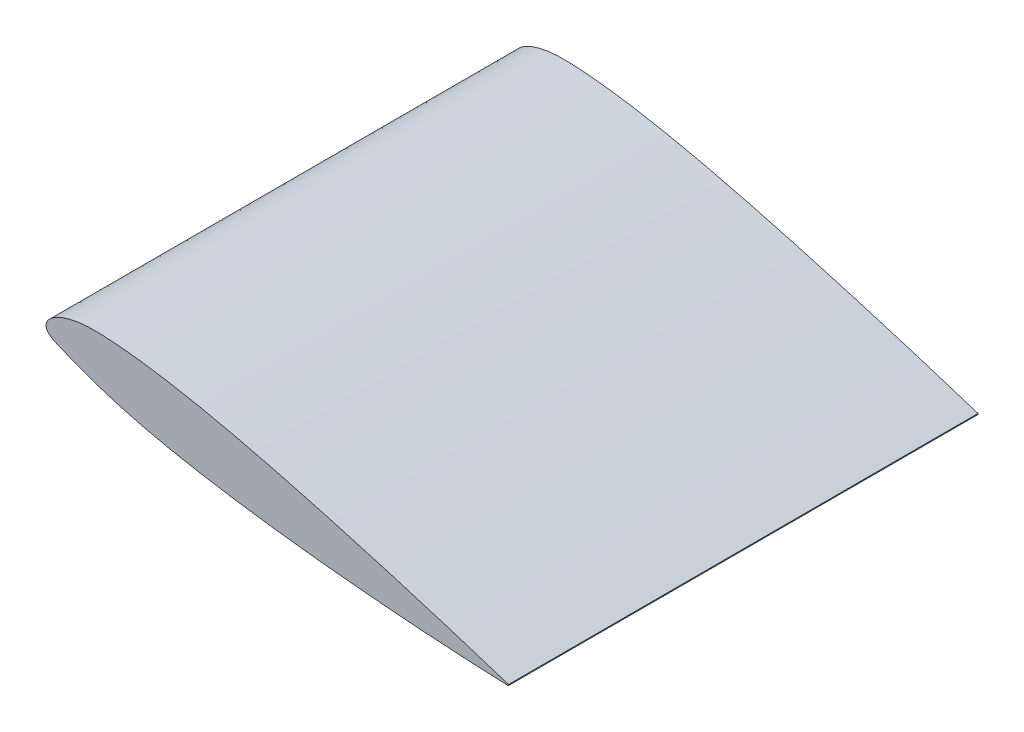
from build123d import *

# Parameters (mm, degrees)
DODANIE_WYCI_GNI_CIE1_DEPTH = 500


with BuildPart() as part:
    # Szkic1 → Dodanie-wyciągnięcie1 (new body)
    with BuildSketch(Plane.XY):
        with BuildLine():
            Line((492.514532323, -86.204604305), (492.294218438, -87.443749292))
            add(Edge.make_bspline(
                [(492.514532323, -86.204604305), (469.152483024, -78.583559389), (429.191484222, -65.955455251), (373.797941733, -49.213240078), (325.443584595, -35.138653635), (281.023077325, -22.791525732), (239.326810577, -11.873309739), (201.862573325, -2.74759553), (169.200176625, 4.43198713), (141.682179262, 9.771081889), (119.433550099, 13.55266704), (101.67731023, 16.071355866), (88.207332583, 17.639022387), (78.730250949, 18.57177721), (69.625256549, 19.280445731), (60.821621177, 19.795263903), (52.273200813, 20.002879597), (44.047461568, 19.801980118), (36.268948428, 19.136969261), (29.056406515, 17.997313874), (22.515698028, 16.414598562), (16.732940773, 14.453682717), (11.769799675, 12.200987485), (7.661928414, 9.7513984), (4.420468462, 7.195324449), (2.037015901, 4.606346205), (0.493738145, 2.031358482), (-0.210133755, -0.508697618), (-0.058149366, -2.946555825), (0.868989261, -5.185817941), (2.475331688, -7.181041906), (4.655854189, -8.973414863), (7.353096196, -10.634998092), (10.523884067, -12.228346842), (14.132589876, -13.810433146), (18.155001803, -15.433262226), (22.584201679, -17.143556135), (27.434997574, -18.98198675), (34.875610137, -21.7848252), (43.060806905, -24.853718515), (52.123341765, -28.136676915), (59.986299109, -30.844268252), (75.017801124, -35.612499898), (94.607150078, -40.977085849), (122.923774169, -47.618756118), (153.964968391, -53.841813539), (190.761311957, -60.059905003), (228.985634296, -65.565110319), (271.835199276, -70.884697303), (317.771503669, -75.729474382), (368.025663904, -80.179627678), (420.250946058, -83.971902478), (461.683839573, -86.229328513), (486.25619753, -87.22115636), (491.834044294, -87.426892383), (492.294218438, -87.443749292)],
                knots=[0, 0, 0, 0, 0.072255025, 0.123222089, 0.170150758, 0.220331601, 0.258781731, 0.296881738, 0.33370442, 0.357104545, 0.379297669, 0.400055439, 0.409830087, 0.419169499, 0.428054093, 0.436681353, 0.445096795, 0.453189549, 0.460862875, 0.468034876, 0.474639206, 0.480625941, 0.485962658, 0.490636119, 0.494655605, 0.498059761, 0.500929183, 0.503404007, 0.505690993, 0.507976562, 0.510416375, 0.513147824, 0.516239073, 0.519713615, 0.52357445, 0.527821966, 0.532466294, 0.537534822, 0.543074939, 0.555844991, 0.563237839, 0.571415939, 0.580295189, 0.609601939, 0.631115834, 0.665807087, 0.702674524, 0.740833419, 0.779352204, 0.829629038, 0.87664464, 0.92769048, 0.983588069, 0.998646023, 1, 1, 1, 1], degree=3))
        make_face()
    extrude(amount=DODANIE_WYCI_GNI_CIE1_DEPTH)


solid = part.part
